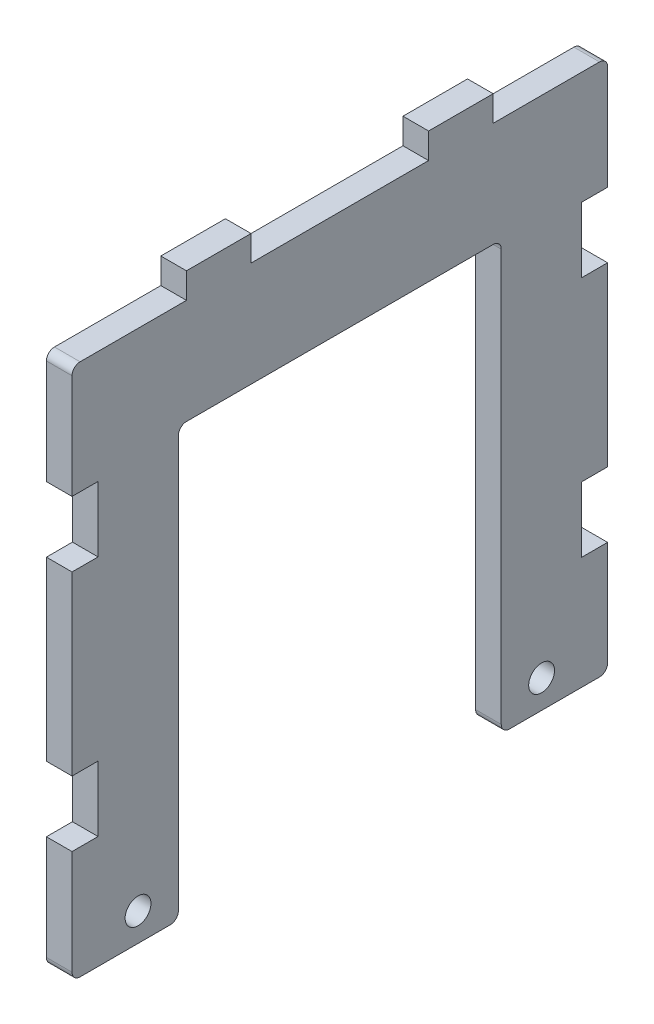
from build123d import *

# Parameters (mm, degrees)
SKETCH2_W            = 66.35
SKETCH2_H            = 66
BOSS_EXTRUDE1_DEPTH  = 3.175
CUT_EXTRUDE1_DEPTH   = 47.900546372
M3_CLEARANCE_HOLE1_D = 3.2
SKETCH7_W            = 3.225
SKETCH7_H            = 8.1
CUT_EXTRUDE2_DEPTH   = 47.900546372
SKETCH8_W            = 8
SKETCH8_H            = 3.175
BOSS_EXTRUDE2_DEPTH  = 3.175
FILLET1_R            = 1
FILLET2_R            = 1


with BuildPart() as part:
    # Sketch2 → Boss-Extrude1 (new body)
    with BuildSketch(Plane(origin=(0, 0, 0), x_dir=(0, 0, -1), z_dir=(1, 0, 0))):
        Rectangle(SKETCH2_W, SKETCH2_H)
    extrude(amount=BOSS_EXTRUDE1_DEPTH)

    # Sketch3 → Cut-Extrude1 (cut, through all)
    with BuildSketch(Plane(origin=(3.175, 0, 0), x_dir=(0, 0, -1), z_dir=(1, 0, 0))):
        Polygon((-20, -20), (-20, -33), (20, -33), (20, -20), (20, 20), (-20, 20), align=None)
    extrude(amount=-CUT_EXTRUDE1_DEPTH, mode=Mode.SUBTRACT)

    # M3 Clearance Hole1 (through all)
    with Locations(Plane(origin=(3.175, 0, 0), x_dir=(0, 0, -1), z_dir=(1, 0, 0))):
        with Locations((-25, -29.5), (25, -29.5)):
            Hole(M3_CLEARANCE_HOLE1_D / 2)

    # Sketch7 → Cut-Extrude2 (cut, through all)
    with BuildSketch(Plane(origin=(3.175, 0, 0), x_dir=(0, 0, -1), z_dir=(1, 0, 0))):
        with Locations((-31.5625, 15)):
            Rectangle(SKETCH7_W, SKETCH7_H)
        with Locations((-31.5625, -15)):
            Rectangle(SKETCH7_W, SKETCH7_H)
        with Locations((31.5625, -15)):
            Rectangle(SKETCH7_W, SKETCH7_H)
        with Locations((31.5625, 15)):
            Rectangle(SKETCH7_W, SKETCH7_H)
    extrude(amount=-CUT_EXTRUDE2_DEPTH, mode=Mode.SUBTRACT)

    # Sketch8 → Boss-Extrude2 (add)
    with BuildSketch(Plane(origin=(3.175, 0, 0), x_dir=(0, 0, -1), z_dir=(1, 0, 0))):
        with Locations((-15, 34.5875)):
            Rectangle(SKETCH8_W, SKETCH8_H)
        with Locations((15, 34.5875)):
            Rectangle(SKETCH8_W, SKETCH8_H)
    extrude(amount=-BOSS_EXTRUDE2_DEPTH)

    # Fillet1
    fillet1_edges = [part.edges().sort_by_distance(p)[0] for p in [
        (1.5875, 20, -20),
        (1.5875, 20, 20),
    ]]
    fillet(fillet1_edges, radius=FILLET1_R)

    # Fillet2
    fillet2_edges = [part.edges().sort_by_distance(p)[0] for p in [
        (1.5875, -33, -20),
        (1.5875, -33, 20),
        (1.5875, -33, -33.175),
        (1.5875, -33, 33.175),
        (1.5875, 33, 33.175),
        (1.5875, 33, -33.175),
    ]]
    fillet(fillet2_edges, radius=FILLET2_R)


solid = part.part
